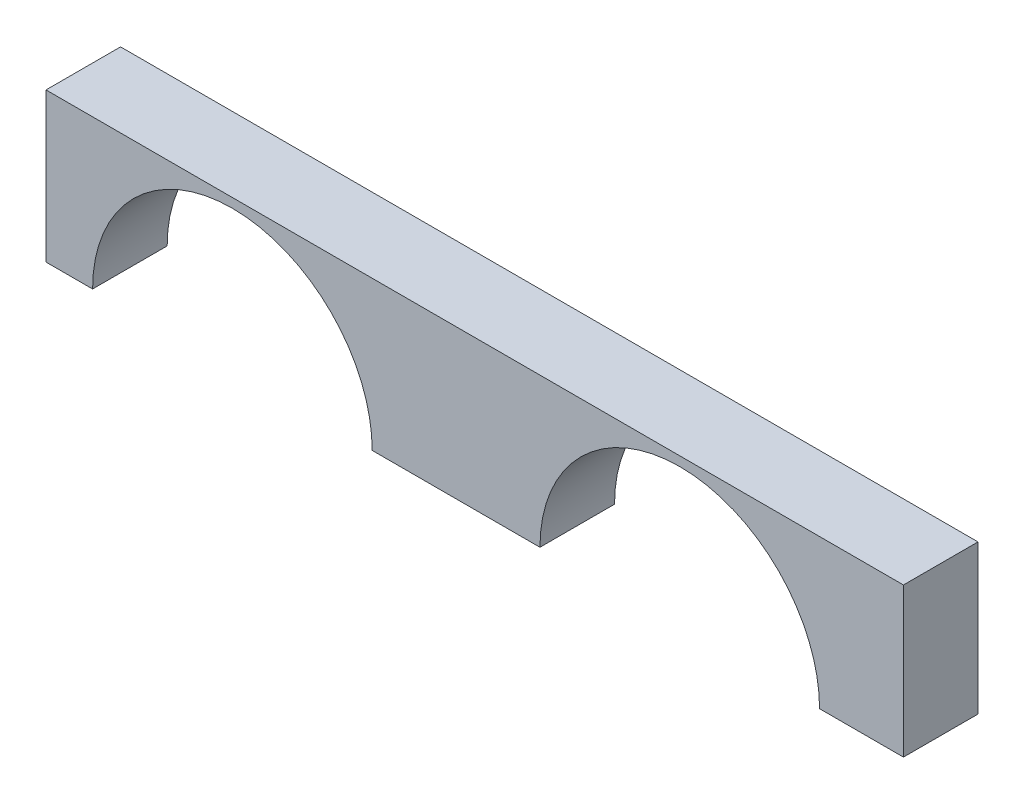
from build123d import *

# Parameters (mm, degrees)
SKETCH1_W           = 230
SKETCH1_H           = 40
BOSS_EXTRUDE1_DEPTH = 20
SKETCH2_R           = 37.5
CUT_EXTRUDE1_DEPTH  = 235.307490277


with BuildPart() as part:
    # Sketch1 → Boss-Extrude1 (new body)
    with BuildSketch(Plane.XY):
        with Locations((115, 20)):
            Rectangle(SKETCH1_W, SKETCH1_H)
    extrude(amount=BOSS_EXTRUDE1_DEPTH)

    # Sketch2 → Cut-Extrude1 (cut, through all)
    with BuildSketch(Plane.XY.offset(20)):
        with Locations((50, 0)):
            Circle(SKETCH2_R)
        with Locations((170, 0)):
            Circle(SKETCH2_R)
    extrude(amount=-CUT_EXTRUDE1_DEPTH, mode=Mode.SUBTRACT)


solid = part.part
